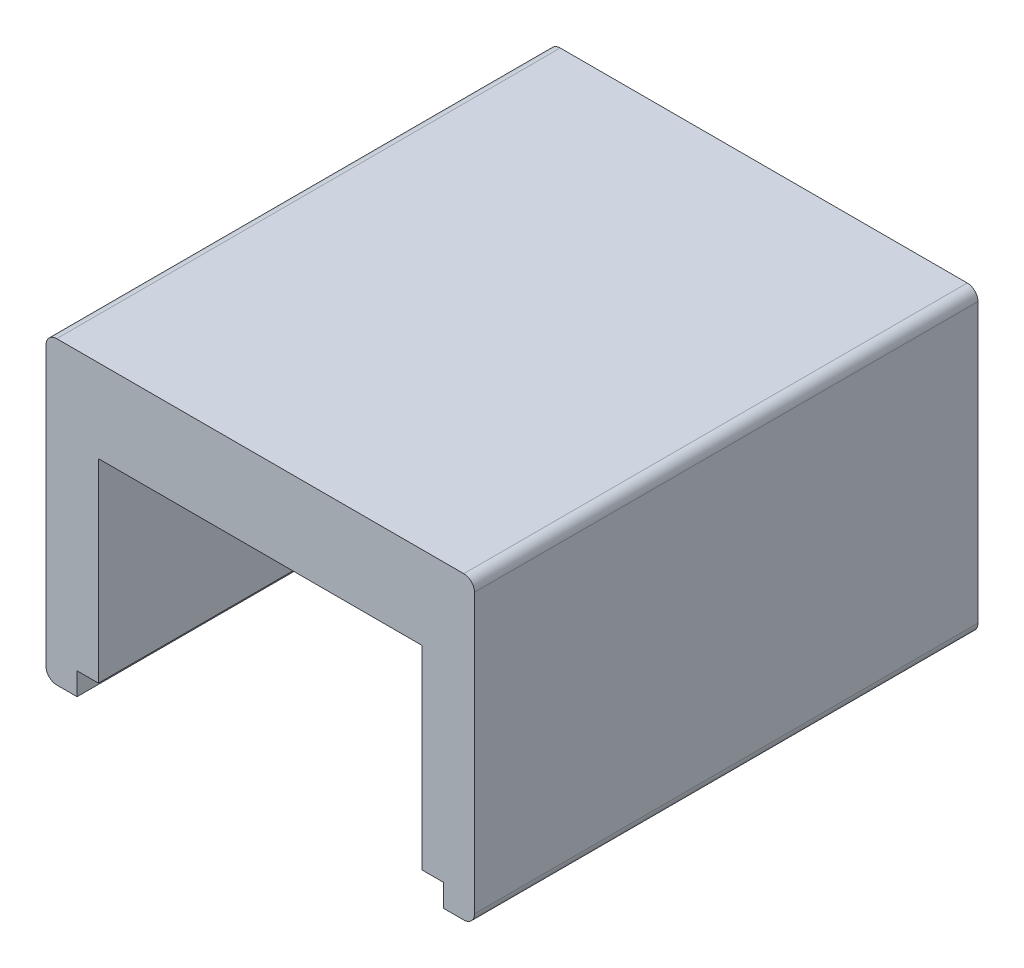
from build123d import *

# Parameters (mm, degrees)
SKETCH1_W           = 80
SKETCH1_H           = 56
SKETCH1_W_2         = 60.4
SKETCH1_H_2         = 30.2
BOSS_EXTRUDE1_DEPTH = 94
CUT_EXTRUDE1_DEPTH  = 136.543350999
FILLET1_R           = 2


with BuildPart() as part:
    # Sketch1 → Boss-Extrude1 (new body)
    with BuildSketch(Plane.XY):
        with Locations((40, 28)):
            Rectangle(SKETCH1_W, SKETCH1_H)
        with Locations((40, 25.4)):
            Rectangle(SKETCH1_W_2, SKETCH1_H_2, mode=Mode.SUBTRACT)
    extrude(amount=BOSS_EXTRUDE1_DEPTH)

    # Sketch2 → Cut-Extrude1 (cut, through all)
    with BuildSketch(Plane.XY.offset(94)):
        Polygon((9.8, 10.3), (70.2, 10.3), (70.2, 4.2), (74.2, 4.2), (74.2, 0), (70, 0), (10, 0), (5.8, 0), (5.8, 4.2), (9.8, 4.2), align=None)
    extrude(amount=-CUT_EXTRUDE1_DEPTH, mode=Mode.SUBTRACT)

    # Fillet1
    fillet1_edges = [part.edges().sort_by_distance(p)[0] for p in [
        (0, 56, 47),
        (80, 56, 47),
        (80, 0, 47),
        (0, 0, 47),
    ]]
    fillet(fillet1_edges, radius=FILLET1_R)


solid = part.part
